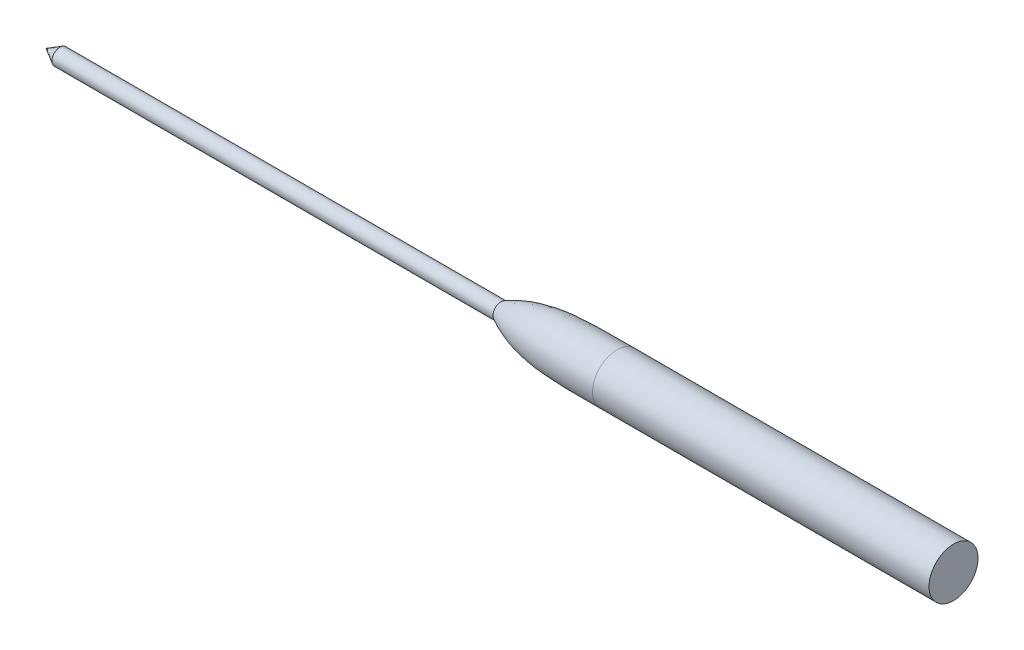
from build123d import *


with BuildPart() as part:
    # Skizze1 → Rotation1 (revolve)
    with BuildSketch(Plane(origin=(0, 0, 0), x_dir=(1, 0, 0), z_dir=(0, 1, 0)), mode=Mode.PRIVATE) as rotation1_sk:
        with BuildLine():
            Line((-693, -12.75), (-703.825317547, -19))
            Line((-703.825317547, -19), (0, -19))
            Line((0, -19), (0, 0))
            Line((0, 0), (-261, 0))
            add(Edge.make_bspline(
                [(-261, 0), (-291.112694808, 0), (-323.638894204, 1.876340116), (-351, -12.75)],
                knots=[0, 0, 0, 0, 1, 1, 1, 1], degree=3))
            Line((-351, -12.75), (-693, -12.75))
        make_face()
    revolve(rotation1_sk.sketch.rotate(Axis((-703.825317547, 0, 19), (1, 0, 0)), 180), axis=Axis((-703.825317547, 0, 19), (1, 0, 0)))


solid = part.part
